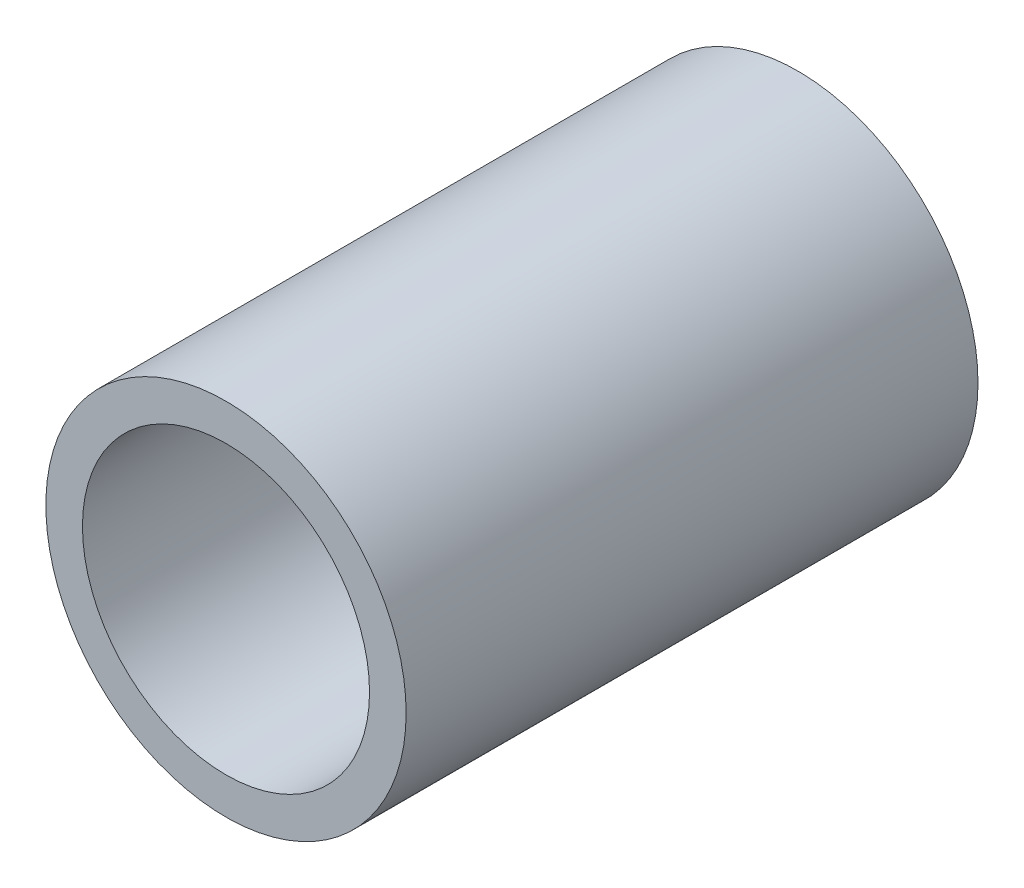
from build123d import *

# Parameters (mm, degrees)
SKETCH1_R           = 4.0005
SKETCH1_R_2         = 3.1877
BOSS_EXTRUDE1_DEPTH = 6.35


with BuildPart() as part:
    # Sketch1 → Boss-Extrude1 (new, symmetric)
    with BuildSketch(Plane.XY):
        Circle(SKETCH1_R)
        Circle(SKETCH1_R_2, mode=Mode.SUBTRACT)
    extrude(amount=BOSS_EXTRUDE1_DEPTH, both=True)


solid = part.part
